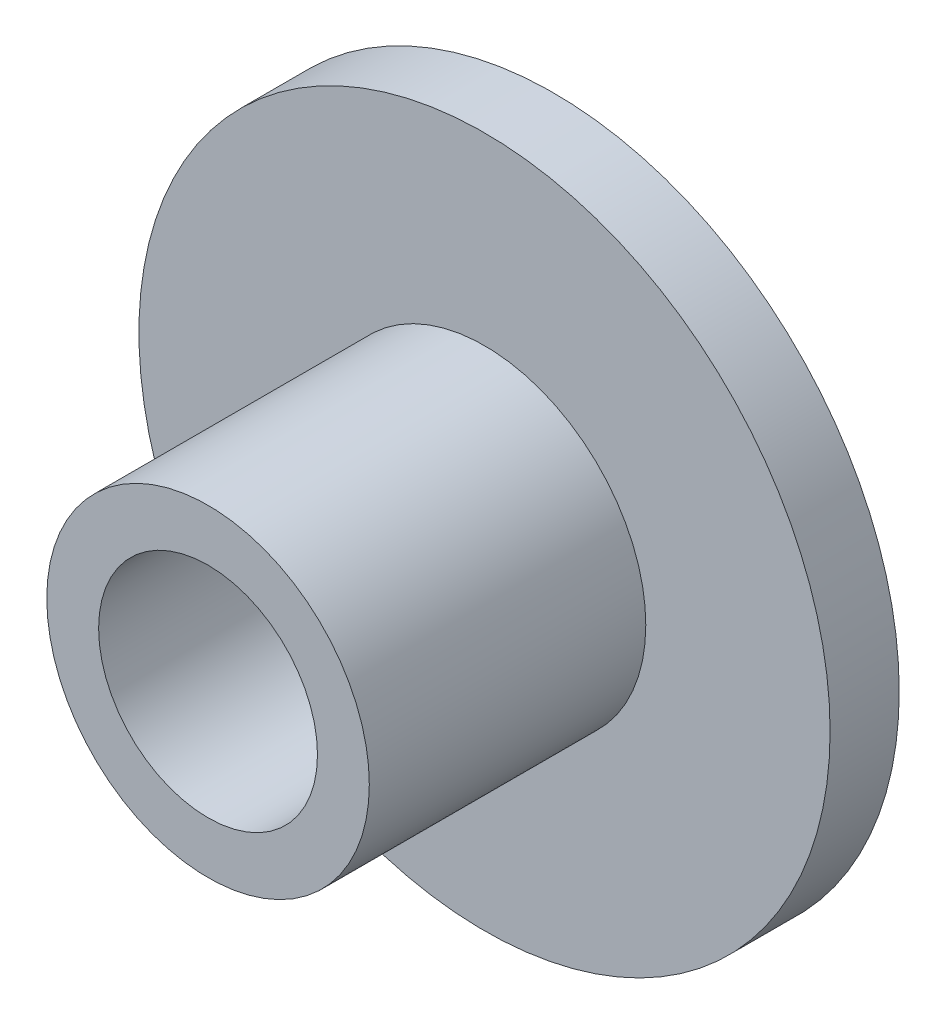
from build123d import *

# Parameters (mm, degrees)
SKETCH1_R           = 15
SKETCH1_R_2         = 4.75
BOSS_EXTRUDE1_DEPTH = 15
CUT_EXTRUDE1_START  = -12
SKETCH2_R           = 15
SKETCH2_R_2         = 7
CUT_EXTRUDE1_DEPTH  = 12


with BuildPart() as part:
    # Sketch1 → Boss-Extrude1 (new body)
    with BuildSketch(Plane.XY):
        Circle(SKETCH1_R)
        Circle(SKETCH1_R_2, mode=Mode.SUBTRACT)
    extrude(amount=BOSS_EXTRUDE1_DEPTH)

    # Sketch2 → Cut-Extrude1 (cut)
    with BuildSketch(Plane.XY.offset(15).offset(CUT_EXTRUDE1_START)):
        Circle(SKETCH2_R)
        Circle(SKETCH2_R_2, mode=Mode.SUBTRACT)
    extrude(amount=CUT_EXTRUDE1_DEPTH, mode=Mode.SUBTRACT)


solid = part.part
